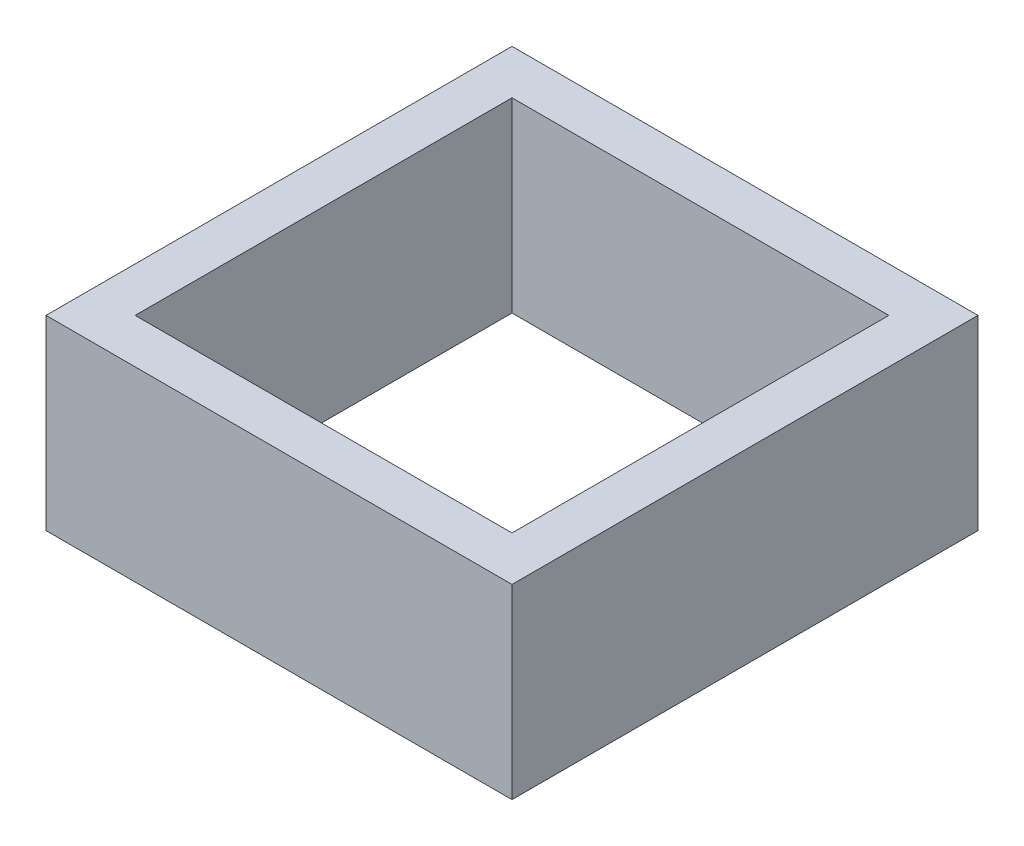
from build123d import *

# Parameters (mm, degrees)
ESQUISSE1_W        = 230
ESQUISSE1_H        = 230
ESQUISSE1_W_2      = 186
ESQUISSE1_H_2      = 186
BOSS_EXTRU_1_DEPTH = 92


with BuildPart() as part:
    # Esquisse1 → Boss.-Extru.1 (new body)
    with BuildSketch(Plane(origin=(0, 0, 0), x_dir=(1, 0, 0), z_dir=(0, 1, 0))):
        Rectangle(ESQUISSE1_W, ESQUISSE1_H)
        Rectangle(ESQUISSE1_W_2, ESQUISSE1_H_2, mode=Mode.SUBTRACT)
    extrude(amount=BOSS_EXTRU_1_DEPTH)


solid = part.part
